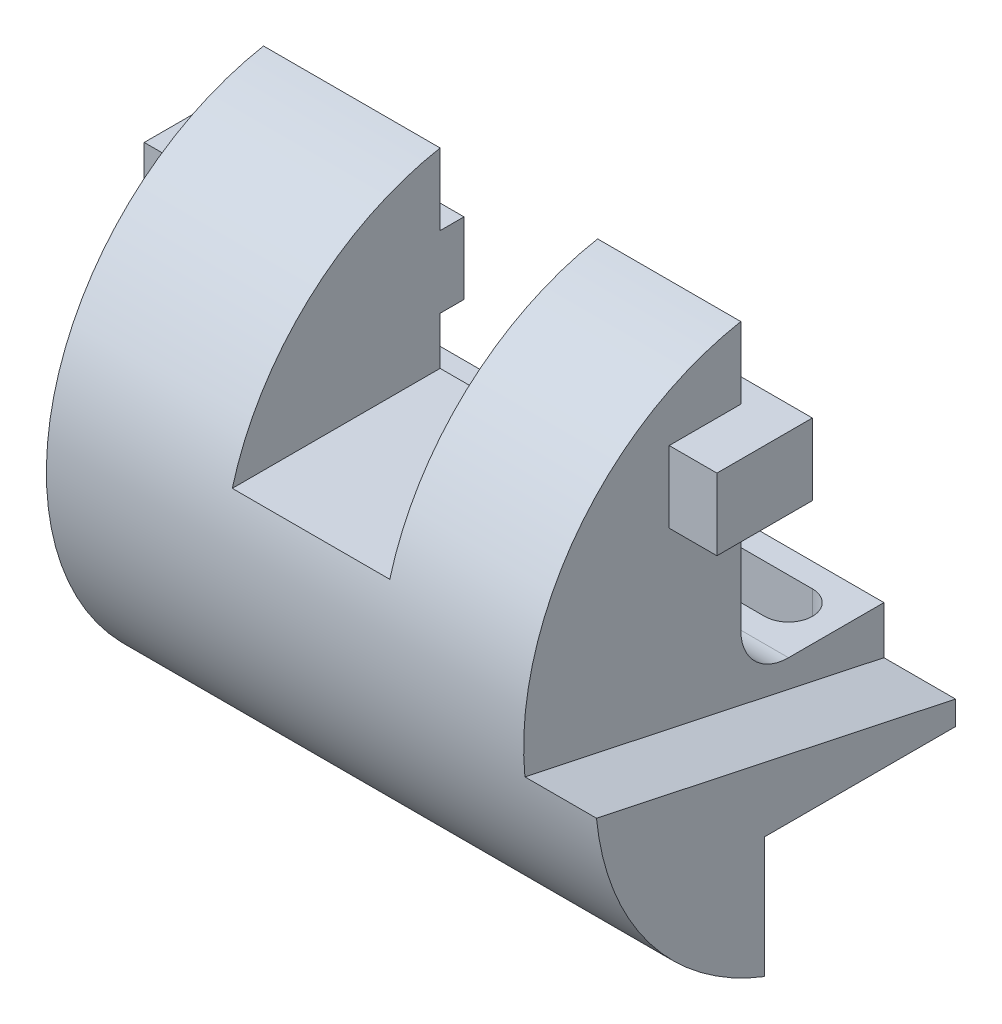
from build123d import *

# Parameters (mm, degrees)
BOSS_EXTRUDE1_DEPTH      = 115
CUT_EXTRUDE1_DEPTH       = 153.581945197
CUT_EXTRUDE1_DEPTH_BACK  = 15
BOSS_EXTRUDE2_DEPTH      = 10
BOSS_EXTRUDE2_DEPTH_BACK = 110
SKETCH3_W                = 20
SKETCH3_H                = 15
CUT_EXTRUDE2_DEPTH       = 153.581945197
SKETCH5_W                = 33
SKETCH5_H                = 40
CUT_EXTRUDE3_DEPTH       = 142.884636237


with BuildPart() as part:
    # Sketch1 → Boss-Extrude1 (new body)
    with BuildSketch(Plane(origin=(0, 0, 0), x_dir=(0, 0, -1), z_dir=(1, 0, 0))):
        with BuildLine():
            Line((0, 0), (0, -15))
            Line((0, -15), (-40, -15))
            Line((-40, -15), (-40, -40.362796982))
            ThreePointArc((-40, -40.362796982), (-75.256322222, 16.603413808), (-30, 66))
            Line((-30, 66), (-30, 10))
            ThreePointArc((-30, 10), (-27.071067812, 2.928932188), (-20, 0))
            Line((-20, 0), (0, 0))
        make_face()
    extrude(amount=BOSS_EXTRUDE1_DEPTH)

    # Sketch2 → Cut-Extrude1 (cut, two sides: drawn at the far end of the back side and taken through both)
    with BuildSketch(Plane(origin=(115, 0, 0), x_dir=(0, 0, -1), z_dir=(1, 0, 0)).offset(-CUT_EXTRUDE1_DEPTH_BACK)):
        with BuildLine():
            Line((-75.235044142, 5.9917023), (0, -10))
            Line((0, -10), (0, 0))
            Line((0, 0), (-20, 0))
            ThreePointArc((-20, 0), (-27.071067812, 2.928932188), (-30, 10))
            Line((-30, 10), (-30, 66))
            ThreePointArc((-30, 66), (-64.318751046, 44.816391467), (-75.235044142, 5.9917023))
        make_face()
    extrude(amount=CUT_EXTRUDE1_DEPTH + CUT_EXTRUDE1_DEPTH_BACK, mode=Mode.SUBTRACT)

    # Sketch3 → Boss-Extrude2 (add, two sides: drawn at the far end of the back side and taken through both)
    with BuildSketch(Plane.ZY.offset(-BOSS_EXTRUDE2_DEPTH_BACK)):
        with Locations((35, 43.5)):
            Rectangle(SKETCH3_W, SKETCH3_H)
    extrude(amount=BOSS_EXTRUDE2_DEPTH + BOSS_EXTRUDE2_DEPTH_BACK)

    # Sketch4 → Cut-Extrude2 (cut, through all)
    with BuildSketch(Plane(origin=(0, 0, 0), x_dir=(1, 0, 0), z_dir=(0, 1, 0))):
        with BuildLine():
            Line((10, -5), (90, -5))
            ThreePointArc((90, -5), (95, -10), (90, -15))
            Line((90, -15), (10, -15))
            ThreePointArc((10, -15), (5, -10), (10, -5))
        make_face()
    extrude(amount=-CUT_EXTRUDE2_DEPTH, mode=Mode.SUBTRACT)

    # Sketch5 → Cut-Extrude3 (cut, through all)
    with BuildSketch(Plane(origin=(0, 0, 25), x_dir=(-1, 0, 0), z_dir=(0, 0, -1))):
        with Locations((-53.5, 46)):
            Rectangle(SKETCH5_W, SKETCH5_H)
    extrude(amount=-CUT_EXTRUDE3_DEPTH, mode=Mode.SUBTRACT)


solid = part.part
